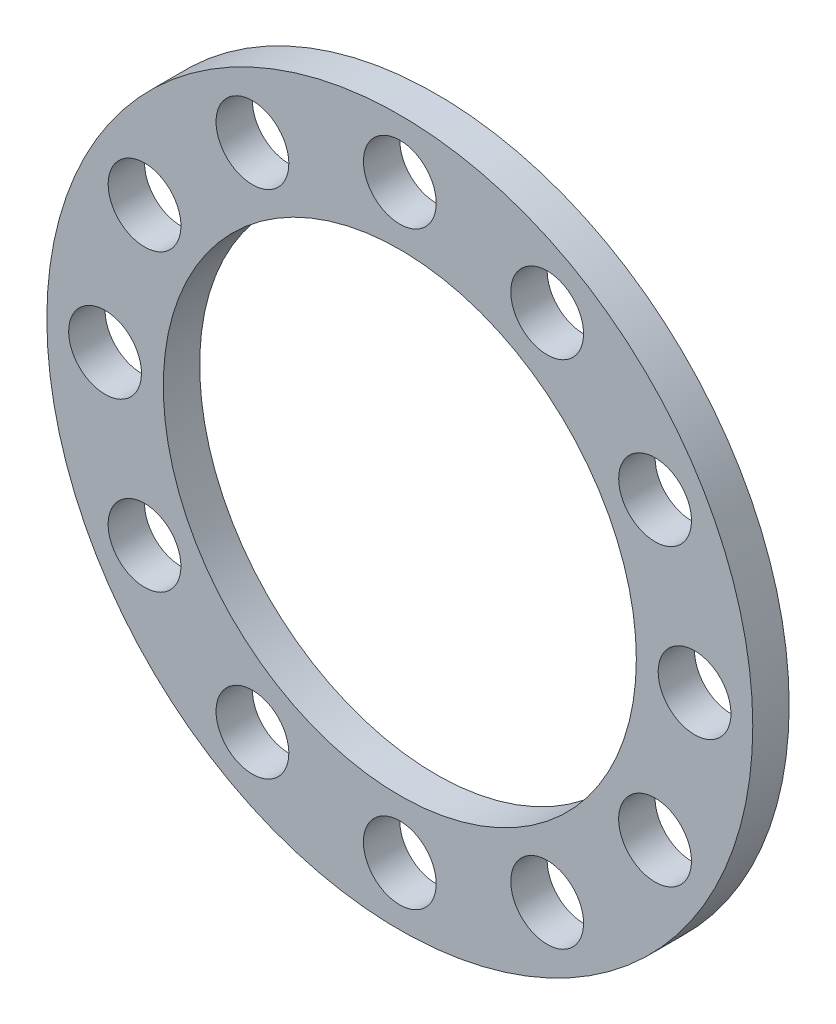
from build123d import *

# Parameters (mm, degrees)
SKETCH1_R         = 48.5
SKETCH1_R_2       = 32.5
BODY_DEPTH        = 5
SKETCH2_R         = 5
BOLT_HOLE_DEPTH   = 69.771360318
CIRPATTERN1_COUNT = 12


with BuildPart() as part:
    # Sketch1 → Body (new body)
    with BuildSketch(Plane.XY):
        Circle(SKETCH1_R)
        Circle(SKETCH1_R_2, mode=Mode.SUBTRACT)
    extrude(amount=BODY_DEPTH)

    # Sketch2 → Bolt Hole (cut, through all)
    with BuildSketch(Plane.XY.offset(5)):
        with Locations((0, 40.5)):
            Circle(SKETCH2_R)
    bolt_hole = extrude(amount=-BOLT_HOLE_DEPTH, mode=Mode.SUBTRACT)

    # CirPattern1: Bolt Hole ×12 about axis
    cirpattern1_axis = Axis((0, 0, 0), (0, 0, 1))
    for i in range(1, CIRPATTERN1_COUNT):
        add(bolt_hole.rotate(cirpattern1_axis, i * 360 / CIRPATTERN1_COUNT), mode=Mode.SUBTRACT)


solid = part.part
